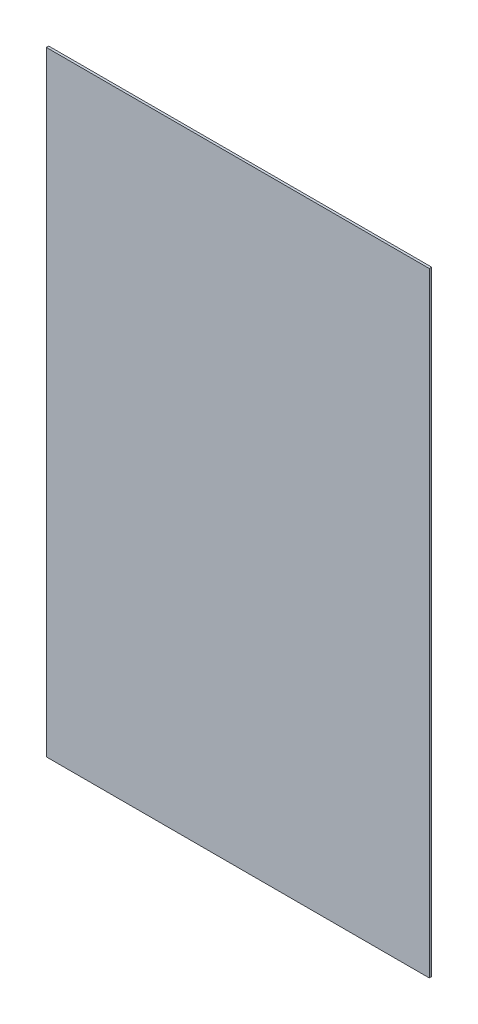
from build123d import *

# Parameters (mm, degrees)
SKETCH1_W           = 480
SKETCH1_H           = 770
BOSS_EXTRUDE1_DEPTH = 3


with BuildPart() as part:
    # Sketch1 → Boss-Extrude1 (new body)
    with BuildSketch(Plane.XY):
        with Locations((-173.368421053, -98.614035088)):
            Rectangle(SKETCH1_W, SKETCH1_H)
    extrude(amount=BOSS_EXTRUDE1_DEPTH)


solid = part.part
